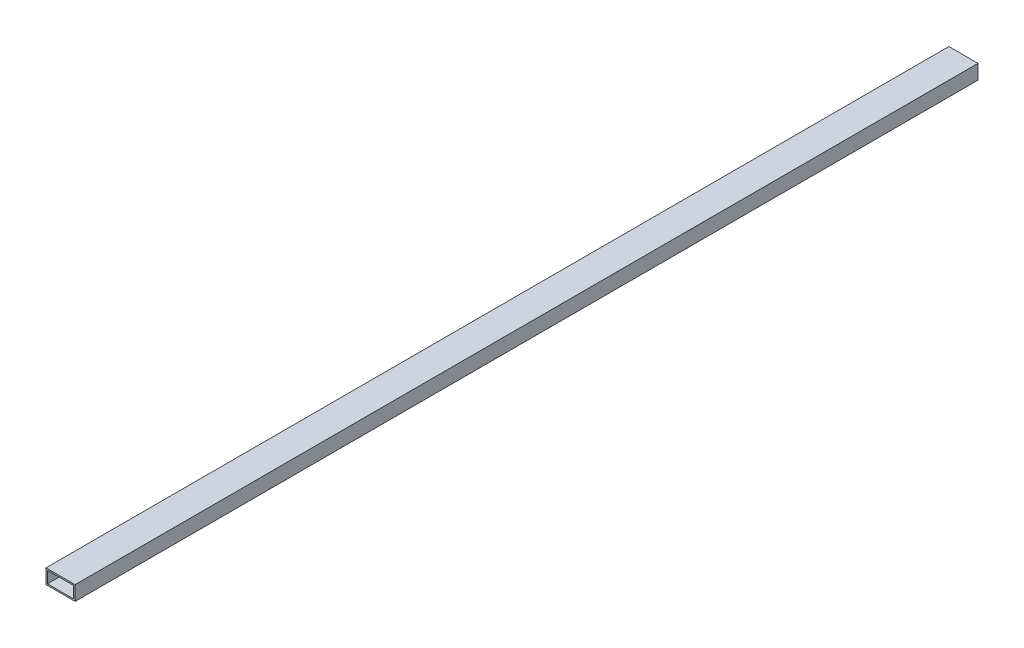
from build123d import *

# Parameters (mm, degrees)
SKETCH_1_W      = 20
SKETCH_1_H      = 10
SKETCH_1_W_2    = 18
SKETCH_1_H_2    = 8
EXTRUDE_1_DEPTH = 620


with BuildPart() as part:
    # 草图1 → 凸台-拉伸1 (new body)
    with BuildSketch(Plane.XY):
        Rectangle(SKETCH_1_W, SKETCH_1_H)
        Rectangle(SKETCH_1_W_2, SKETCH_1_H_2, mode=Mode.SUBTRACT)
    extrude(amount=EXTRUDE_1_DEPTH)


solid = part.part
